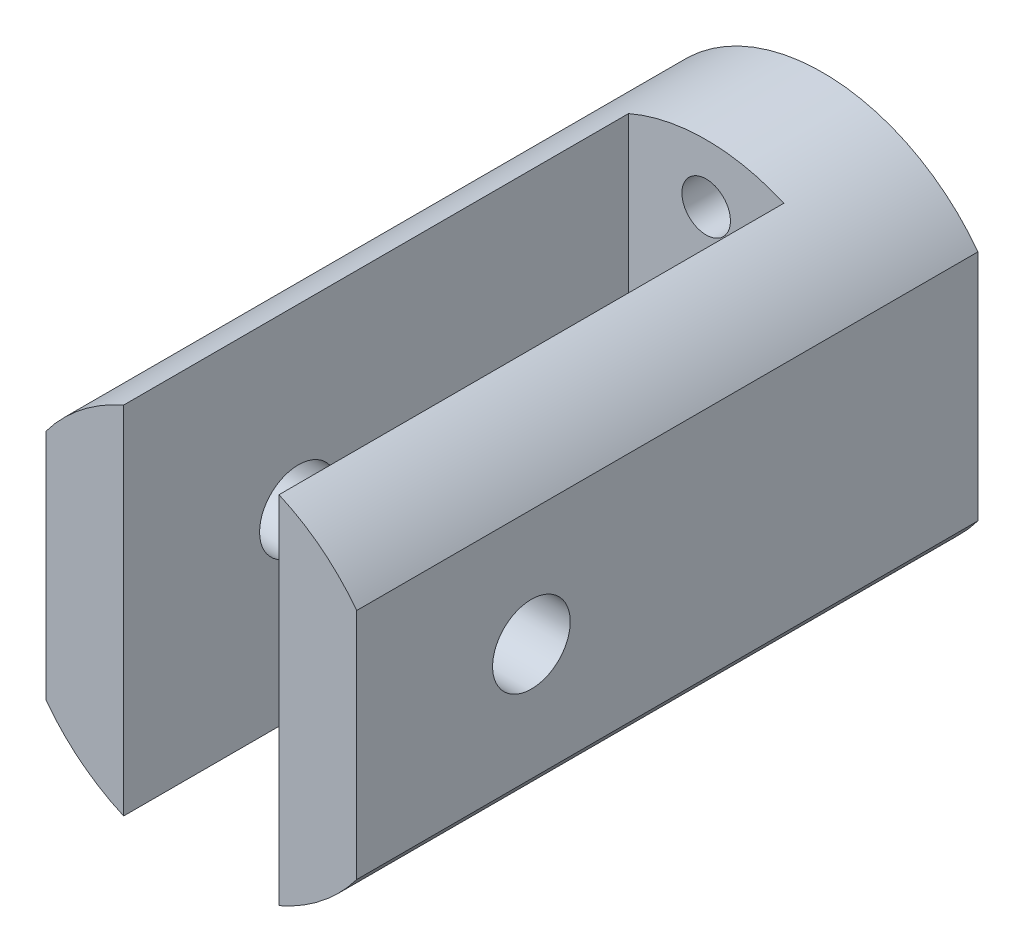
from build123d import *

# Parameters (mm, degrees)
SKETCH_1_R               = 10
EXTRUDE_2_DEPTH          = 32
CUT_EXTRUDE_1_DEPTH      = 35.985711369
CUT_EXTRUDE_1_DEPTH_BACK = 35.985711369
SKETCH_3_W               = 8
SKETCH_3_H               = 26
CUT_EXTRUDE_2_DEPTH      = 35.985711369
CUT_EXTRUDE_2_DEPTH_BACK = 35.985711369
SKETCH_4_W               = 2
SKETCH_4_H               = 32
SKETCH_5_R               = 1.25
CUT_EXTRUDE_3_DEPTH      = 35.467375879
CUT_EXTRUDE_4_DEPTH      = 35.467375879
CUT_EXTRUDE_4_DEPTH_BACK = 35.467375879
SKETCH_6_R               = 2


with BuildPart() as part:
    # 草图1 → 凸台-拉伸2 (new body)
    with BuildSketch(Plane.XY):
        Circle(SKETCH_1_R)
    extrude(amount=EXTRUDE_2_DEPTH)

    # 草图3 → 切除-拉伸1 (cut, two sides: drawn at the far end of the back side and taken through both)
    with BuildSketch(Plane(origin=(0, 0, 0), x_dir=(1, 0, 0), z_dir=(0, 1, 0)).offset(-CUT_EXTRUDE_1_DEPTH_BACK)):
        with Locations((0, -19)):
            Rectangle(SKETCH_3_W, SKETCH_3_H)
    extrude(amount=CUT_EXTRUDE_1_DEPTH + CUT_EXTRUDE_1_DEPTH_BACK, mode=Mode.SUBTRACT)

    # 草图4 → 切除-拉伸2 (cut, two sides: drawn at the far end of the back side and taken through both)
    with BuildSketch(Plane(origin=(0, 0, 0), x_dir=(1, 0, 0), z_dir=(0, 1, 0)).offset(-CUT_EXTRUDE_2_DEPTH_BACK)):
        with Locations((-9, -16)):
            Rectangle(SKETCH_4_W, SKETCH_4_H)
        with Locations((9, -16)):
            Rectangle(SKETCH_4_W, SKETCH_4_H)
    extrude(amount=CUT_EXTRUDE_2_DEPTH + CUT_EXTRUDE_2_DEPTH_BACK, mode=Mode.SUBTRACT)

    # 草图5 → 切除-拉伸3 (cut, through all)
    with BuildSketch(Plane(origin=(0, 0, 0), x_dir=(-1, 0, 0), z_dir=(0, 0, -1))):
        with Locations((0, 7)):
            Circle(SKETCH_5_R)
        with Locations((0, -7)):
            Circle(SKETCH_5_R)
    extrude(amount=-CUT_EXTRUDE_3_DEPTH, mode=Mode.SUBTRACT)

    # 草图6 → 切除-拉伸4 (cut, two sides: drawn at the far end of the back side and taken through both)
    with BuildSketch(Plane(origin=(0, 0, 0), x_dir=(0, 0, -1), z_dir=(1, 0, 0)).offset(-CUT_EXTRUDE_4_DEPTH_BACK)):
        with Locations((-23, 0)):
            Circle(SKETCH_6_R)
    extrude(amount=CUT_EXTRUDE_4_DEPTH + CUT_EXTRUDE_4_DEPTH_BACK, mode=Mode.SUBTRACT)


solid = part.part
